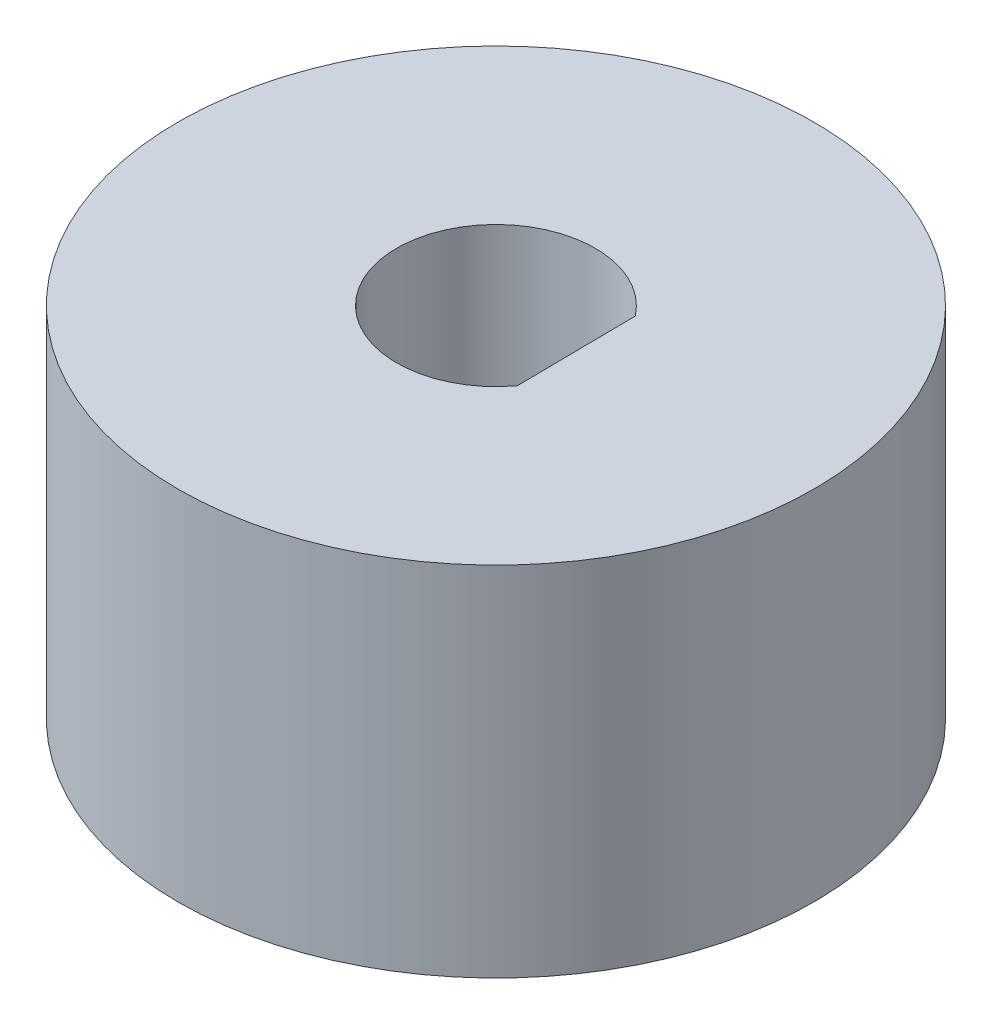
from build123d import *

# Parameters (mm, degrees)
SKETCH_1_R          = 8
EXTRUDE_1_DEPTH     = 9
CUT_EXTRUDE_1_DEPTH = 15.456832295


with BuildPart() as part:
    # 草图1 → 凸台-拉伸1 (new body)
    with BuildSketch(Plane(origin=(0, 0, 0), x_dir=(1, 0, 0), z_dir=(0, 1, 0))):
        with Locations(Location((0, 0, 0), (0, 0, 270))):
            Circle(SKETCH_1_R)
    extrude(amount=EXTRUDE_1_DEPTH)

    # 草图2 → 切除-拉伸1 (cut, through all)
    with BuildSketch(Plane(origin=(0, 9, 0), x_dir=(1, 0, 0), z_dir=(0, 1, 0))):
        with BuildLine():
            Line((1.982537386, 1.523005421), (2.017195673, -1.476794372))
            ThreePointArc((2.017195673, -1.476794372), (-2.499833162, -0.028881906), (1.982537386, 1.523005421))
        make_face()
    extrude(amount=-CUT_EXTRUDE_1_DEPTH, mode=Mode.SUBTRACT)


solid = part.part
